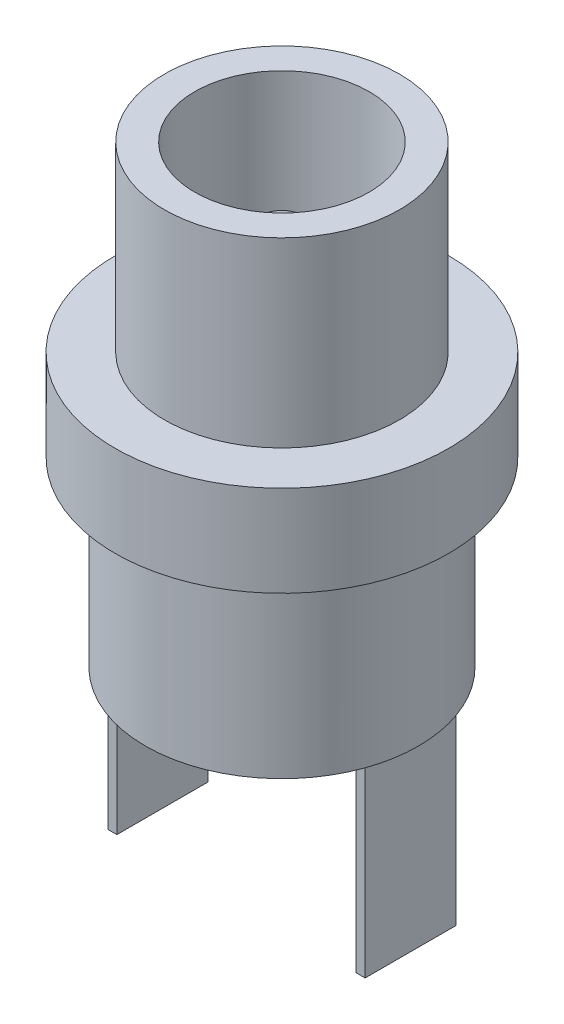
from build123d import *

# Parameters (mm, degrees)
SKIZZE2_W                       = 0.3
SKIZZE2_H                       = 3
SKIZZE2_W_2                     = 3
SKIZZE2_H_2                     = 0.3
AUFSATZ_LINEAR_AUSTRAGEN1_DEPTH = 6
VERRUNDUNG1_R                   = 0.75


with BuildPart() as part:
    # Skizze1 → Rotation1 (revolve)
    with BuildSketch(Plane.XY, mode=Mode.PRIVATE) as rotation1_sk:
        Polygon((-3.875, 0), (-3.875, -6), (-5.5, -6), (-5.5, -9), (-4.5, -9), (-4.5, -15), (0, -15), (0, -2.3), (-1, -2.3), (-1, -10), (-2.875, -10), (-2.875, 0), align=None)
    revolve(rotation1_sk.sketch.rotate(Axis((0, -15, 0), (0, 1, 0)), 270), axis=Axis((0, -15, 0), (0, 1, 0)))

    # Skizze2 → Aufsatz-Linear austragen1 (add)
    with BuildSketch(Plane.XZ.offset(15)):
        with Locations((-4.092640687, 0)):
            Rectangle(SKIZZE2_W, SKIZZE2_H)
        with Locations((4.092640687, 0)):
            Rectangle(SKIZZE2_W, SKIZZE2_H)
        with Locations((0, -4.092640687)):
            Rectangle(SKIZZE2_W_2, SKIZZE2_H_2)
    extrude(amount=AUFSATZ_LINEAR_AUSTRAGEN1_DEPTH)

    # Verrundung1
    verrundung1_edges = [part.edges().sort_by_distance(p)[0] for p in [
        (0, -2.3, 1),
    ]]
    fillet(verrundung1_edges, radius=VERRUNDUNG1_R)


solid = part.part
